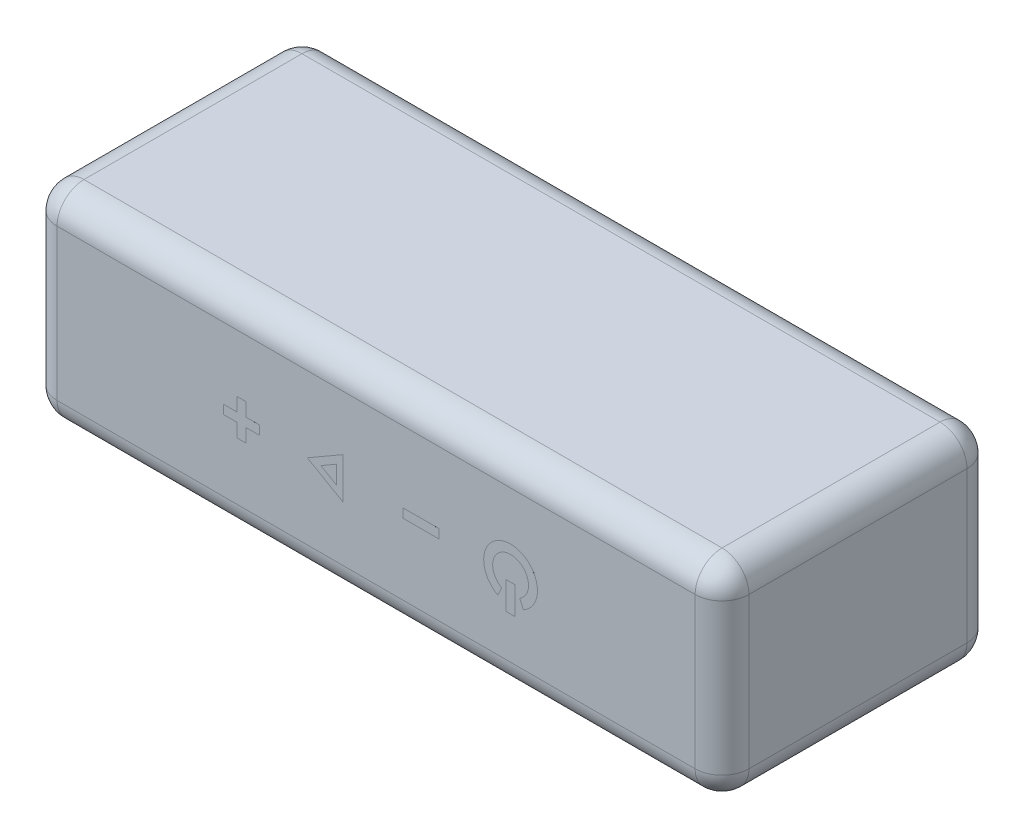
from build123d import *

# Parameters (mm, degrees)
SKETCH1_W           = 196
SKETCH1_H           = 77
BOSS_EXTRUDE1_DEPTH = 58
FILLET1_R           = 7.62
SKETCH2_W           = 2.54
SKETCH2_H           = 7.836102323
SKETCH2_W_2         = 10.16
SKETCH2_H_2         = 2.54
SKETCH2_H_3         = 3.81
SKETCH2_W_3         = 3.81
BOSS_EXTRUDE2_DEPTH = 0.001


with BuildPart() as part:
    # Sketch1 → Boss-Extrude1 (new body)
    with BuildSketch(Plane(origin=(0, 0, 0), x_dir=(1, 0, 0), z_dir=(0, 1, 0))):
        with Locations((98, 38.5)):
            Rectangle(SKETCH1_W, SKETCH1_H)
    extrude(amount=BOSS_EXTRUDE1_DEPTH)

    # Fillet1
    fillet1_edges = [part.edges().sort_by_distance(p)[0] for p in [
        (196, 58, -38.5),
        (98, 58, -77),
        (0, 58, -38.5),
        (98, 0, -77),
        (196, 0, -38.5),
        (98, 0, 0),
        (0, 0, -38.5),
        (0, 29, -77),
        (196, 29, -77),
        (196, 29, 0),
        (0, 29, 0),
        (98, 58, 0),
    ]]
    fillet(fillet1_edges, radius=FILLET1_R)

    # Sketch2 → Boss-Extrude2 (add)
    # profile 1 of 9: a face of its own
    with BuildSketch(Plane.XY):
        with BuildLine():
            Line((139.698967869, 22.283465903), (138.706339513, 24.639564891))
            ThreePointArc((138.706339513, 24.639564891), (136.061823348, 34.079856548), (133.559491145, 24.600884776))
            Line((133.559491145, 24.600884776), (132.489888668, 22.289448892))
            ThreePointArc((132.489888668, 22.289448892), (136.10632402, 36.619997376), (139.698967869, 22.283465903))
        make_face()
    # profile 2 of 9: a face of its own
    with BuildSketch(Plane.XY):
        with Locations((136.1, 23.360894571)):
            Rectangle(SKETCH2_W, SKETCH2_H)
    # profile 3 of 9: a face of its own
    with BuildSketch(Plane.XY):
        with Locations((110.7, 29)):
            Rectangle(SKETCH2_W_2, SKETCH2_H_2)
    # profile 4 of 9: a face of its own
    with BuildSketch(Plane.XY):
        Polygon((88.686666667, 23.134121265), (88.686666667, 34.865878735), (78.526666667, 29), align=None)
        Polygon((82.336666667, 29), (86.781666667, 26.433678053), (86.781666667, 31.566321947), align=None, mode=Mode.SUBTRACT)
    # profile 5 of 9: a face of its own
    with BuildSketch(Plane.XY):
        with Locations((59.9, 32.175)):
            Rectangle(SKETCH2_W, SKETCH2_H_3)
    # profile 6 of 9: a face of its own
    with BuildSketch(Plane.XY):
        with Locations((63.075, 29)):
            Rectangle(SKETCH2_W_3, SKETCH2_H_2)
    # profile 7 of 9: a face of its own
    with BuildSketch(Plane.XY):
        with Locations((59.9, 29)):
            Rectangle(SKETCH2_W, SKETCH2_H_2)
    # profile 8 of 9: a face of its own
    with BuildSketch(Plane.XY):
        with Locations((59.9, 25.825)):
            Rectangle(SKETCH2_W, SKETCH2_H_3)
    # profile 9 of 9: a face of its own
    with BuildSketch(Plane.XY):
        with Locations((56.725, 29)):
            Rectangle(SKETCH2_W_3, SKETCH2_H_2)
    extrude(amount=BOSS_EXTRUDE2_DEPTH)


solid = part.part
